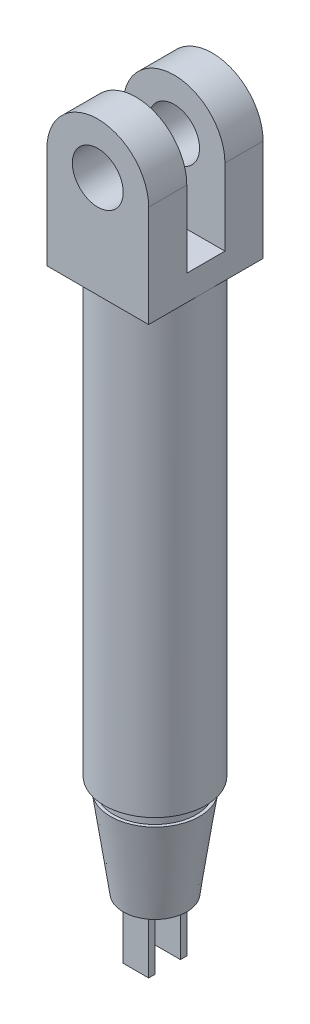
from build123d import *

# Parameters (mm, degrees)
SKETCH_2_W      = 16
SKETCH_2_H      = 18
EXTRUDE_1_DEPTH = 4
EXTRUDE_START   = 3
SKETCH_3_R      = 4
EXTRUDE_3_DEPTH = 6
EXTRUDE_START_2 = 2
SKETCH_4_W      = 4
SKETCH_4_H      = 9
EXTRUDE_4_DEPTH = 1


with BuildPart() as part:
    # 草图1 → 旋转1 (revolve)
    with BuildSketch(Plane.XY, mode=Mode.PRIVATE) as revolve_1_sk:
        Polygon((8, 70), (0, 70), (0, -16), (5, -16), (7, -2), (6.5, -2), (6.5, 0), (8, 0), align=None)
    revolve(revolve_1_sk.sketch.rotate(Axis((0, 70, 0), (0, -1, 0)), 180), axis=Axis((0, 70, 0), (0, -1, 0)))

    # 草图2 → 凸台-拉伸1 (add)
    with BuildSketch(Plane(origin=(0, 70, 0), x_dir=(1, 0, 0), z_dir=(0, 1, 0))):
        Rectangle(SKETCH_2_W, SKETCH_2_H)
    extrude(amount=EXTRUDE_1_DEPTH)

    # 草图3 → 凸台-拉伸3 (add)
    with BuildSketch(Plane.XY.offset(EXTRUDE_START)):
        with BuildLine():
            Line((-8, 74), (-8, 86))
            ThreePointArc((-8, 86), (0, 94), (8, 86))
            Line((8, 86), (8, 74))
            Line((8, 74), (-8, 74))
        make_face()
        with Locations((0, 86)):
            Circle(SKETCH_3_R, mode=Mode.SUBTRACT)
    extrude_3 = extrude(amount=EXTRUDE_3_DEPTH)

    # 镜向1: 凸台-拉伸3 across plane
    add(extrude_3.mirror(Plane.XY))

    # 草图4 → 凸台-拉伸4 (add)
    with BuildSketch(Plane.XY.offset(EXTRUDE_START_2)):
        with Locations((0, -20.5)):
            Rectangle(SKETCH_4_W, SKETCH_4_H)
    extrude_4 = extrude(amount=EXTRUDE_4_DEPTH)

    # 镜向2: 凸台-拉伸4 across plane
    add(extrude_4.mirror(Plane.XY))


solid = part.part
